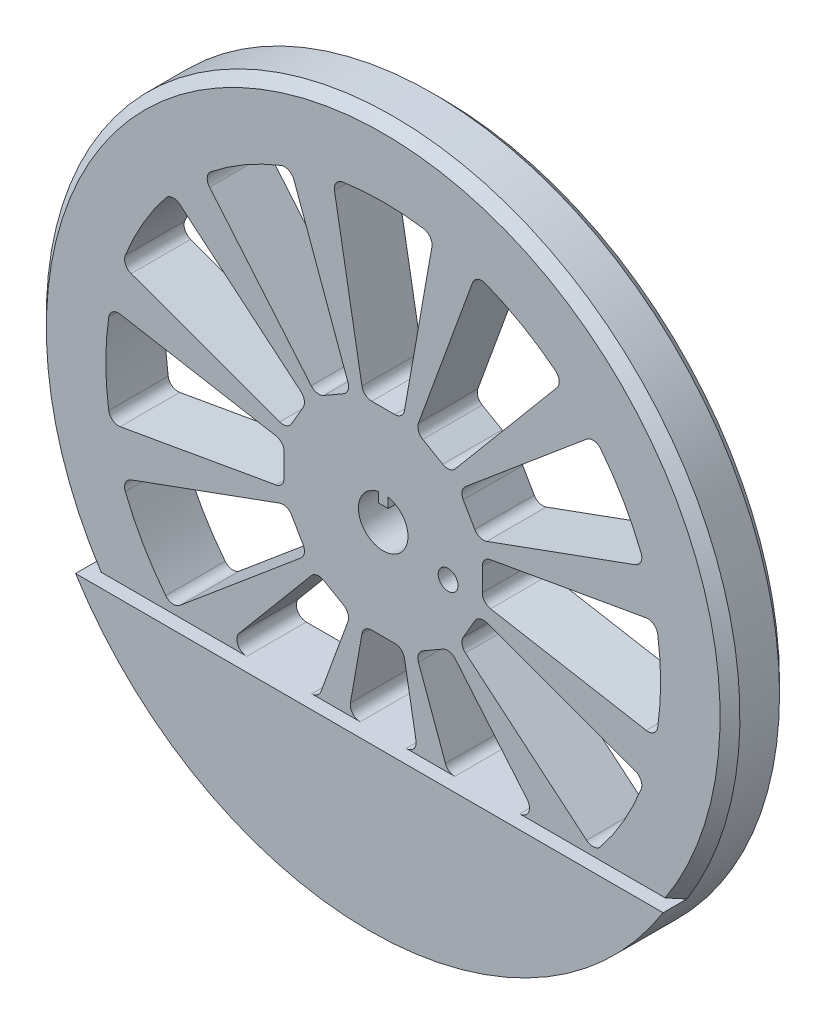
from build123d import *
from build123d.topology import SkipClean

# Parameters (mm, degrees)
SKETCH2_R           = 175
SKETCH2_R_2         = 5
BOSS_EXTRUDE1_DEPTH = 15
CHAMFER1_SIZE       = 5
FILLET1_R           = 5
FILLET2_R           = 5
BOSS_EXTRUDE2_START = 22
BOSS_EXTRUDE2_DEPTH = 22


with BuildPart() as part:
    # Sketch2 → Boss-Extrude1 (new, symmetric)
    with BuildSketch(Plane.XY):
        Circle(SKETCH2_R)
        Polygon((16.339745962, -48.301270189), (33.660254038, -38.301270189), (79.557938048, -93), (32.608753123, -93), align=None, mode=Mode.SUBTRACT)
        Polygon((10, -50), (17.58206017, -93), (-17.58206017, -93), (-10, -50), align=None, mode=Mode.SUBTRACT)
        Polygon((-16.339745962, -48.301270189), (-32.608753123, -93), (-79.557938048, -93), (-33.660254038, -38.301270189), align=None, mode=Mode.SUBTRACT)
        with BuildLine():
            Line((-50, 10), (-50, -10))
            Line((-50, -10), (-137.66589003, -25.4578617))
            ThreePointArc((-137.66589003, -25.4578617), (-140, 0), (-137.66589003, 25.4578617))
            Line((-137.66589003, 25.4578617), (-50, 10))
        make_face(mode=Mode.SUBTRACT)
        with BuildLine():
            Line((-48.301270189, -16.339745962), (-38.301270189, -33.660254038))
            Line((-38.301270189, -33.660254038), (-106.49322715, -90.880099973))
            ThreePointArc((-106.49322715, -90.880099973), (-121.24355653, -70), (-131.95108885, -46.785790057))
            Line((-131.95108885, -46.785790057), (-48.301270189, -16.339745962))
        make_face(mode=Mode.SUBTRACT)
        with BuildLine():
            Line((38.301270189, -33.660254038), (48.301270189, -16.339745962))
            Line((48.301270189, -16.339745962), (131.95108885, -46.785790057))
            ThreePointArc((131.95108885, -46.785790057), (121.24355653, -70), (106.49322715, -90.880099973))
            Line((106.49322715, -90.880099973), (38.301270189, -33.660254038))
        make_face(mode=Mode.SUBTRACT)
        with Locations((32.7390252, -8.772395363)):
            Circle(SKETCH2_R_2, mode=Mode.SUBTRACT)
        with BuildLine():
            Line((-38.301270189, 33.660254038), (-48.301270189, 16.339745962))
            Line((-48.301270189, 16.339745962), (-131.95108885, 46.785790057))
            ThreePointArc((-131.95108885, 46.785790057), (-121.24355653, 70), (-106.49322715, 90.880099973))
            Line((-106.49322715, 90.880099973), (-38.301270189, 33.660254038))
        make_face(mode=Mode.SUBTRACT)
        with BuildLine():
            Line((-16.339745962, 48.301270189), (-33.660254038, 38.301270189))
            Line((-33.660254038, 38.301270189), (-90.880099973, 106.49322715))
            ThreePointArc((-90.880099973, 106.49322715), (-70, 121.24355653), (-46.785790057, 131.95108885))
            Line((-46.785790057, 131.95108885), (-16.339745962, 48.301270189))
        make_face(mode=Mode.SUBTRACT)
        with BuildLine():
            Line((10, 50), (-10, 50))
            Line((-10, 50), (-25.4578617, 137.66589003))
            ThreePointArc((-25.4578617, 137.66589003), (0, 140), (25.4578617, 137.66589003))
            Line((25.4578617, 137.66589003), (10, 50))
        make_face(mode=Mode.SUBTRACT)
        with BuildLine():
            Line((-2.5, 12.247448714), (-2.5, 7.247448714))
            Line((-2.5, 7.247448714), (2.5, 7.247448714))
            Line((2.5, 7.247448714), (2.5, 12.247448714))
            ThreePointArc((2.5, 12.247448714), (0, -12.5), (-2.5, 12.247448714))
        make_face(mode=Mode.SUBTRACT)
        with BuildLine():
            Line((48.301270189, 16.339745962), (38.301270189, 33.660254038))
            Line((38.301270189, 33.660254038), (106.49322715, 90.880099973))
            ThreePointArc((106.49322715, 90.880099973), (121.24355653, 70), (131.95108885, 46.785790057))
            Line((131.95108885, 46.785790057), (48.301270189, 16.339745962))
        make_face(mode=Mode.SUBTRACT)
        with BuildLine():
            Line((33.660254038, 38.301270189), (16.339745962, 48.301270189))
            Line((16.339745962, 48.301270189), (46.785790057, 131.95108885))
            ThreePointArc((46.785790057, 131.95108885), (70, 121.24355653), (90.880099973, 106.49322715))
            Line((90.880099973, 106.49322715), (33.660254038, 38.301270189))
        make_face(mode=Mode.SUBTRACT)
        with BuildLine():
            Line((50, -10), (50, 10))
            Line((50, 10), (137.66589003, 25.4578617))
            ThreePointArc((137.66589003, 25.4578617), (140, 0), (137.66589003, -25.4578617))
            Line((137.66589003, -25.4578617), (50, -10))
        make_face(mode=Mode.SUBTRACT)
    extrude(amount=BOSS_EXTRUDE1_DEPTH, both=True)

    # Chamfer1
    chamfer1_edges = [part.edges().sort_by_distance(p)[0] for p in [
        (-175, 0, -15),
        (-175, 0, 15),
    ]]
    chamfer(chamfer1_edges, length=CHAMFER1_SIZE)

    # Fillet1
    fillet1_edges = [part.edges().sort_by_distance(p)[0] for p in [
        (10, 50, 0),
        (-10, 50, 0),
        (-33.660254038, -38.301270189, 0),
        (-16.339745962, -48.301270189, 0),
        (-10, -50, 0),
        (10, -50, 0),
        (16.339745962, -48.301270189, 0),
        (33.660254038, -38.301270189, 0),
        (38.301270189, -33.660254038, 0),
        (48.301270189, -16.339745962, 0),
        (50, -10, 0),
        (50, 10, 0),
        (48.301270189, 16.339745962, 0),
        (38.301270189, 33.660254038, 0),
        (33.660254038, 38.301270189, 0),
        (16.339745962, 48.301270189, 0),
        (-48.301270189, -16.339745962, 0),
        (-38.301270189, 33.660254038, 0),
        (-50, 10, 0),
        (-33.660254038, 38.301270189, 0),
        (-38.301270189, -33.660254038, 0),
        (-50, -10, 0),
        (-48.301270189, 16.339745962, 0),
        (-16.339745962, 48.301270189, 0),
    ]]
    fillet(fillet1_edges, radius=FILLET1_R)

    # Fillet2
    fillet2_edges = [part.edges().sort_by_distance(p)[0] for p in [
        (-46.785790057, 131.95108885, 0),
        (-90.880099973, 106.49322715, 0),
        (-106.49322715, 90.880099973, 0),
        (-131.95108885, 46.785790057, 0),
        (-137.66589003, 25.4578617, 0),
        (-137.66589003, -25.4578617, 0),
        (-131.95108885, -46.785790057, 0),
        (137.66589003, 25.4578617, 0),
        (106.49322715, 90.880099973, 0),
        (46.785790057, 131.95108885, 0),
        (131.95108885, -46.785790057, 0),
        (-106.49322715, -90.880099973, 0),
        (106.49322715, -90.880099973, 0),
        (137.66589003, -25.4578617, 0),
        (131.95108885, 46.785790057, 0),
        (90.880099973, 106.49322715, 0),
        (25.4578617, 137.66589003, 0),
        (-25.4578617, 137.66589003, 0),
        (-32.608753123, -93, 0),
        (-17.58206017, -93, 0),
        (17.58206017, -93, 0),
        (32.608753123, -93, 0),
        (-79.557938048, -93, 0),
        (79.557938048, -93, 0),
    ]]
    fillet(fillet2_edges, radius=FILLET2_R)

    # Sketch2<3> → Boss-Extrude2 (add)
    with SkipClean():  # the faces are left unmerged after this step: merging them gives an invalid solid
        with BuildSketch(Plane.XY.offset(BOSS_EXTRUDE2_START)):
            with BuildLine():
                Line((148.243043682, -93), (-148.243043682, -93))
                ThreePointArc((-148.243043682, -93), (0, -175), (148.243043682, -93))
            make_face()
        extrude(amount=-BOSS_EXTRUDE2_DEPTH)


solid = part.part
